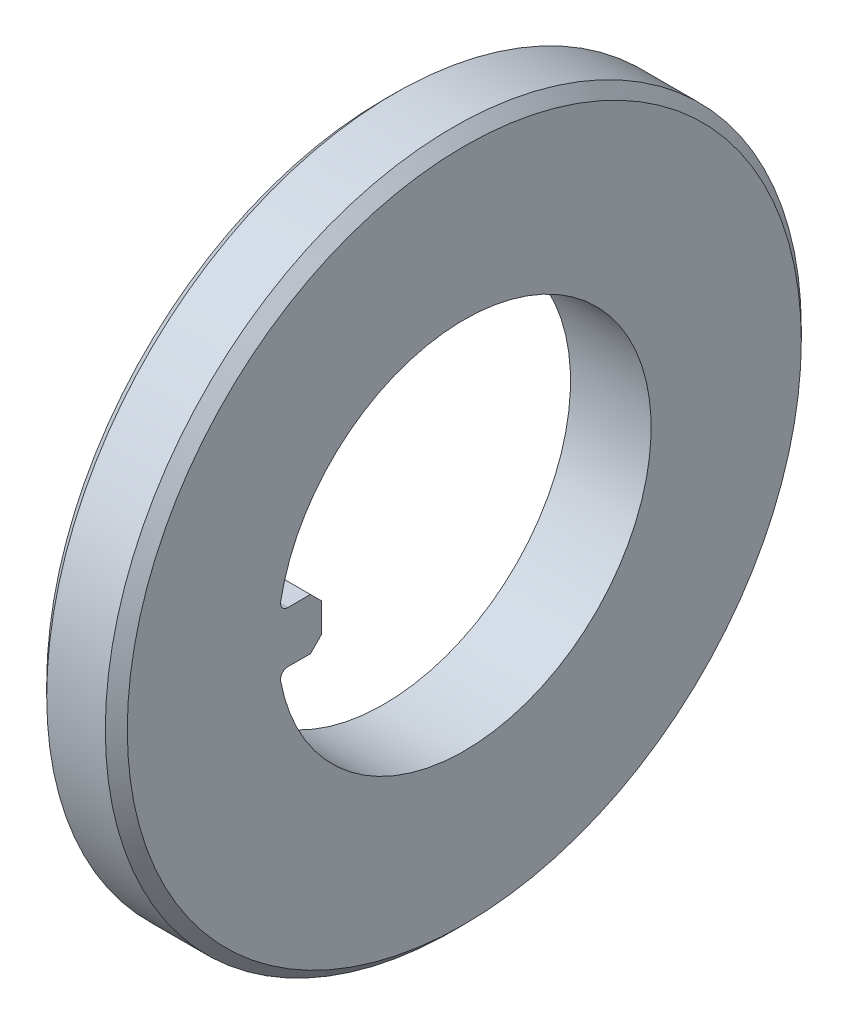
from build123d import *

# Parameters (mm, degrees)
CROQUIS1_R              = 19
SALIENTE_EXTRUIR1_DEPTH = 4.4
CHAFL_N1_SIZE           = 0.6
CHAFL_N2_SIZE           = 0.6
REDONDEO1_R             = 0.4


with BuildPart() as part:
    # Croquis1 → Saliente-Extruir1 (new body)
    with BuildSketch(Plane.YZ):
        with Locations(Location((0, 0, 0), (0, 0, 270))):
            Circle(CROQUIS1_R)
        with BuildLine():
            Line((1.4, 10.103464752), (1.4, 7.8))
            Line((1.4, 7.8), (-1.4, 7.8))
            Line((-1.4, 7.8), (-1.4, 10.103464752))
            ThreePointArc((-1.4, 10.103464752), (0, -10.2), (1.4, 10.103464752))
        make_face(mode=Mode.SUBTRACT)
    extrude(amount=SALIENTE_EXTRUIR1_DEPTH)

    # Chaflán1
    chafl_n1_edges = [part.edges().sort_by_distance(p)[0] for p in [
        (0, 0, 19),
        (4.4, 0, 19),
    ]]
    chamfer(chafl_n1_edges, length=CHAFL_N1_SIZE)

    # Chaflán2
    chafl_n2_edges = [part.edges().sort_by_distance(p)[0] for p in [
        (2.2, 1.4, 7.8),
        (2.2, -1.4, 7.8),
    ]]
    chamfer(chafl_n2_edges, length=CHAFL_N2_SIZE)

    # Redondeo1
    redondeo1_edges = [part.edges().sort_by_distance(p)[0] for p in [
        (2.2, -1.4, 10.103464752),
        (2.2, 1.4, 10.103464752),
    ]]
    fillet(redondeo1_edges, radius=REDONDEO1_R)


solid = part.part
